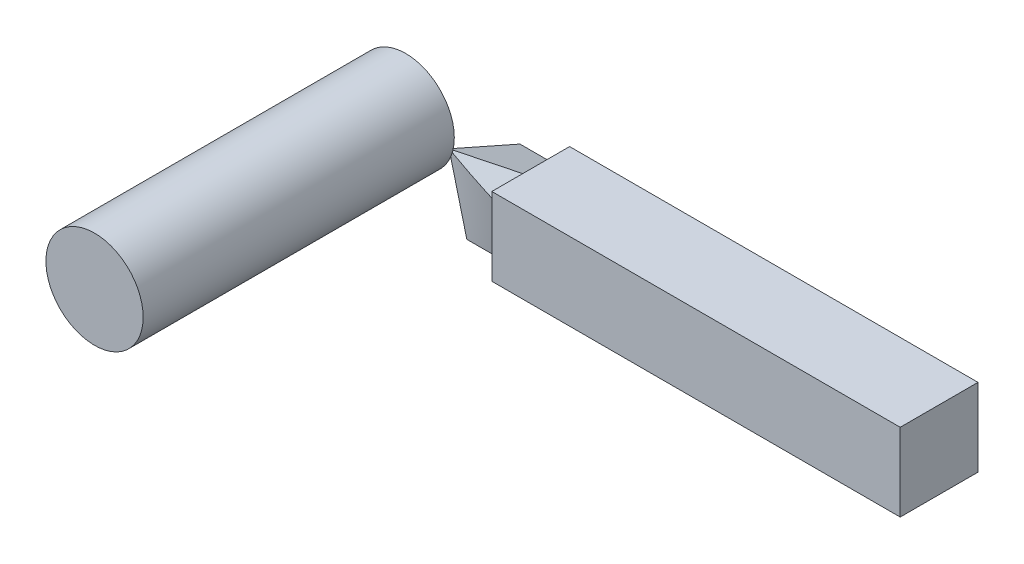
from build123d import *

# Parameters (mm, degrees)
SKETCH1_W           = 20
SKETCH1_H           = 20
BOSS_EXTRUDE1_DEPTH = 120
CUT_EXTRUDE1_DEPTH  = 120
CUT_EXTRUDE2_DEPTH  = 120
CUT_EXTRUDE7_DEPTH  = 15
CUT_EXTRUDE9_DEPTH  = 28
CUT_EXTRUDE10_DEPTH = 15
SKETCH6_12_W        = 4.019237886
SKETCH6_12_H        = 20
CUT_EXTRUDE12_DEPTH = 15
CUT_EXTRUDE14_DEPTH = 24
CUT_EXTRUDE15_DEPTH = 15
CUT_EXTRUDE13_DEPTH = 24
SKETCH14_R          = 12.5
BOSS_EXTRUDE2_DEPTH = 80


with BuildPart() as part:
    # Sketch1 → Boss-Extrude1 (new body)
    with BuildSketch(Plane(origin=(0, 0, 0), x_dir=(0, 0, -1), z_dir=(1, 0, 0))):
        Rectangle(SKETCH1_W, SKETCH1_H)
    extrude(amount=BOSS_EXTRUDE1_DEPTH)

    # Sketch4 → Cut-Extrude1 (cut)
    with BuildSketch(Plane(origin=(0, 10, 0), x_dir=(1, 0, 0), z_dir=(0, 1, 0))):
        Polygon((15, -10), (0, -5.980762114), (0, -10), align=None)
        Polygon((0, 10), (0, -5.980762114), (2.245949647, 10), align=None)
    extrude(amount=-CUT_EXTRUDE1_DEPTH, mode=Mode.SUBTRACT)

    # Sketch5 → Cut-Extrude2 (cut)
    with BuildSketch(Plane.XY.offset(10)):
        Polygon((15, 10), (0, 10), (15, 7.355095289), align=None)
        Polygon((2.455691218, -10), (0, 10), (0, -10), align=None)
    extrude(amount=-CUT_EXTRUDE2_DEPTH, mode=Mode.SUBTRACT)

    # Sketch6 → Cut-Extrude7 (cut)
    with BuildSketch(Plane(origin=(0, 0, 0), x_dir=(0, 0, -1), z_dir=(1, 0, 0))):
        Polygon((10, 10), (-5.980762114, 10), (10, 4.18347827), align=None)
    extrude(amount=CUT_EXTRUDE7_DEPTH, mode=Mode.SUBTRACT)

    # Sketch7 → Cut-Extrude9 (cut)
    with BuildSketch(Plane(origin=(0, 10, 0), x_dir=(1, 0, 0), z_dir=(0, 1, 0))):
        with BuildLine():
            Line((15, -10), (0.683663186, -6.163949112))
            ThreePointArc((0.683663186, -6.163949112), (0.223609764, -5.832758039), (0.098503967, -5.27986997))
            Line((0.098503967, -5.27986997), (2.245949647, 10))
            Line((2.245949647, 10), (-4.807920497, 10))
            Line((-4.807920497, 10), (-4.807920497, -10))
            Line((-4.807920497, -10), (15, -10))
        make_face()
    extrude(amount=-CUT_EXTRUDE9_DEPTH, mode=Mode.SUBTRACT)

    # Sketch6<9> → Cut-Extrude10 (cut)
    with BuildSketch(Plane(origin=(0, 0, 0), x_dir=(0, 0, -1), z_dir=(1, 0, 0))):
        Polygon((-5.980762114, 10), (-5.980762114, -10), (-3.878677408, -10), align=None)
    extrude(amount=CUT_EXTRUDE10_DEPTH, mode=Mode.SUBTRACT)

    # Sketch6<12> → Cut-Extrude12 (cut)
    with BuildSketch(Plane(origin=(0, 0, 0), x_dir=(0, 0, -1), z_dir=(1, 0, 0))):
        with Locations((-7.990381057, 0)):
            Rectangle(SKETCH6_12_W, SKETCH6_12_H)
    extrude(amount=CUT_EXTRUDE12_DEPTH, mode=Mode.SUBTRACT)

    # Sketch10 → Loft1 section 0
    with BuildSketch(Plane(origin=(0, 10, 0), x_dir=(1, 0, 0), z_dir=(0, 1, 0))):
        with BuildLine():
            Line((15, -10), (0, -5.980762114))
            Line((0, -5.980762114), (2.245949647, 10))
            Line((2.245949647, 10), (15, 10))
            Line((15, 10), (15, -10))
        make_face()
    # Sketch9 → Loft1 section 1
    with BuildSketch(Plane.XZ.offset(10)):
        with BuildLine():
            Line((2.455691218, -10), (2.455691218, 3.878677408))
            Line((2.455691218, 3.878677408), (15, 3.878677408))
            Line((15, 3.878677408), (15, -10))
            Line((15, -10), (2.455691218, -10))
        make_face()
    loft()

    # Sketch12 → Cut-Extrude14 (cut)
    with BuildSketch(Plane.XY.offset(10)):
        Polygon((15, 10), (0, 10), (15, 7.355095289), align=None)
        Polygon((2.455691218, -10), (0, 10), (0, -10), align=None)
    extrude(amount=-CUT_EXTRUDE14_DEPTH, mode=Mode.SUBTRACT)

    # Sketch13 → Cut-Extrude15 (cut)
    with BuildSketch(Plane(origin=(0, 0, 0), x_dir=(0, 0, -1), z_dir=(1, 0, 0))):
        Polygon((-5.980762114, 10), (10, 10), (10, 4.18347827), align=None)
    extrude(amount=CUT_EXTRUDE15_DEPTH, mode=Mode.SUBTRACT)

    # Sketch11 → Cut-Extrude13 (cut)
    with BuildSketch(Plane(origin=(0, 10, 0), x_dir=(1, 0, 0), z_dir=(0, 1, 0))):
        with BuildLine():
            Line((15, -10), (0.683663186, -6.163949112))
            ThreePointArc((0.683663186, -6.163949112), (0.223609764, -5.832758039), (0.098503967, -5.27986997))
            Line((0.098503967, -5.27986997), (2.248976463, 10.021536917))
            Line((2.248976463, 10.021536917), (0, 10.021536917))
            Line((0, 10.021536917), (0, -10))
            Line((0, -10), (15, -10))
        make_face()
    extrude(amount=-CUT_EXTRUDE13_DEPTH, mode=Mode.SUBTRACT)


with BuildPart() as body_2:
    # Sketch14 → Boss-Extrude2 (new body)
    with BuildSketch(Plane(origin=(1.880253322, 0, 10), x_dir=(1, 0, 0), z_dir=(0, 0, 1))):
        with Locations((-12.409980622, 13.776560467)):
            Circle(SKETCH14_R)
    extrude(amount=BOSS_EXTRUDE2_DEPTH)


with BuildPart() as body_2_1:
    # Body-Move/Copy1: moved
    add(body_2.part.moved(Location((0, 0, -3.389199925))))


solid = Compound([part.part, body_2_1.part])
